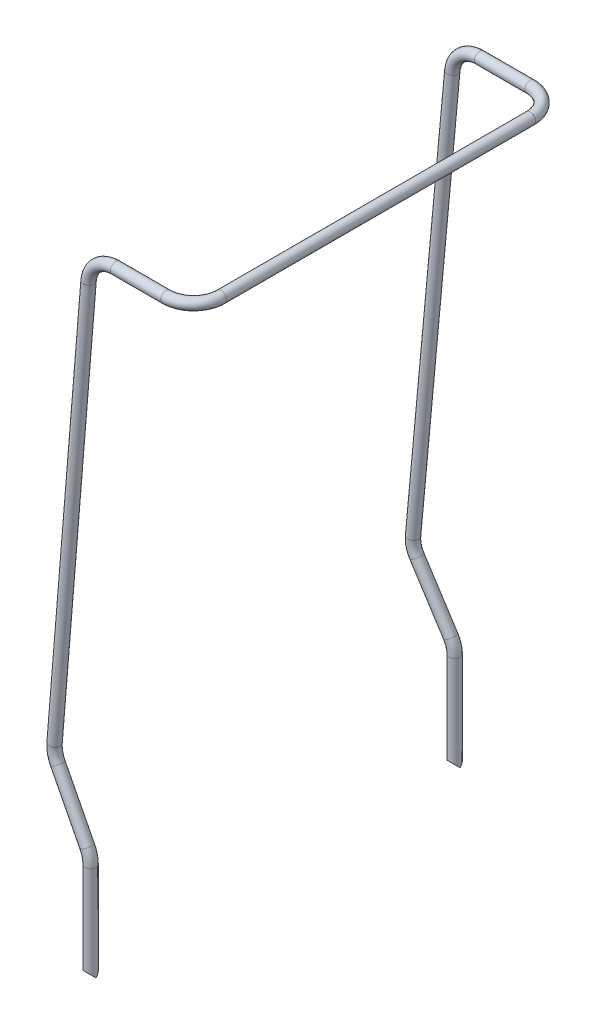
from build123d import *

# Parameters (mm, degrees)
SKETCH1_R                             = 7.9375
SKETCH1_R_2                           = 6.4375
PIPE_CONFIGURED_21_3_X_2_3_5_DEPTH    = 139.269057496
SKETCH1_ON_SEGMENT_2_R                = 7.9375
SKETCH1_ON_SEGMENT_2_R_2              = 6.4375
PIPE_CONFIGURED_21_3_X_2_3_5_2_ANGLE  = 30
SKETCH1_ON_SEGMENT_3_R                = 7.9375
SKETCH1_ON_SEGMENT_3_R_2              = 6.4375
PIPE_CONFIGURED_21_3_X_2_3_5_3_DEPTH  = 92.155116602
SKETCH1_ON_SEGMENT_4_R                = 7.9375
SKETCH1_ON_SEGMENT_4_R_2              = 6.4375
PIPE_CONFIGURED_21_3_X_2_3_5_4_ANGLE  = 35
SKETCH1_ON_SEGMENT_5_R                = 7.9375
SKETCH1_ON_SEGMENT_5_R_2              = 6.4375
PIPE_CONFIGURED_21_3_X_2_3_5_5_DEPTH  = 613.247713082
SKETCH1_ON_SEGMENT_6_R                = 7.9375
SKETCH1_ON_SEGMENT_6_R_2              = 6.4375
PIPE_CONFIGURED_21_3_X_2_3_5_6_ANGLE  = 85.012738731
SKETCH1_ON_SEGMENT_7_R                = 7.9375
SKETCH1_ON_SEGMENT_7_R_2              = 6.4375
PIPE_CONFIGURED_21_3_X_2_3_5_7_DEPTH  = 73.338571858
SKETCH1_ON_SEGMENT_8_R                = 7.9375
SKETCH1_ON_SEGMENT_8_R_2              = 6.4375
PIPE_CONFIGURED_21_3_X_2_3_5_8_ANGLE  = 90
SKETCH1_ON_SEGMENT_9_R                = 7.9375
SKETCH1_ON_SEGMENT_9_R_2              = 6.4375
PIPE_CONFIGURED_21_3_X_2_3_5_9_DEPTH  = 450
SKETCH1_ON_SEGMENT_10_R               = 7.9375
SKETCH1_ON_SEGMENT_10_R_2             = 6.4375
PIPE_CONFIGURED_21_3_X_2_3_5_10_ANGLE = 90
SKETCH1_ON_SEGMENT_11_R               = 7.9375
SKETCH1_ON_SEGMENT_11_R_2             = 6.4375
PIPE_CONFIGURED_21_3_X_2_3_5_11_DEPTH = 73.338571858
SKETCH1_ON_SEGMENT_12_R               = 7.9375
SKETCH1_ON_SEGMENT_12_R_2             = 6.4375
PIPE_CONFIGURED_21_3_X_2_3_5_12_ANGLE = 85.012738731
SKETCH1_ON_SEGMENT_13_R               = 7.9375
SKETCH1_ON_SEGMENT_13_R_2             = 6.4375
PIPE_CONFIGURED_21_3_X_2_3_5_13_DEPTH = 613.247713082
SKETCH1_ON_SEGMENT_14_R               = 7.9375
SKETCH1_ON_SEGMENT_14_R_2             = 6.4375
PIPE_CONFIGURED_21_3_X_2_3_5_14_ANGLE = 35
SKETCH1_ON_SEGMENT_15_R               = 7.9375
SKETCH1_ON_SEGMENT_15_R_2             = 6.4375
PIPE_CONFIGURED_21_3_X_2_3_5_15_DEPTH = 92.155116602
SKETCH1_ON_SEGMENT_16_R               = 7.9375
SKETCH1_ON_SEGMENT_16_R_2             = 6.4375
PIPE_CONFIGURED_21_3_X_2_3_5_16_ANGLE = 30
SKETCH1_ON_SEGMENT_17_R               = 7.9375
SKETCH1_ON_SEGMENT_17_R_2             = 6.4375
PIPE_CONFIGURED_21_3_X_2_3_5_17_DEPTH = 139.269057496
CORTE_EXTRUS_O3_DEPTH                 = 1435.431816843
CORTE_EXTRUS_O3_DEPTH_BACK            = 1435.431816843
ESBO_O12_R                            = 7.9375
ESBO_O14_R                            = 7.9375
CORTE_EXTRUS_O5_DEPTH                 = 30


with BuildPart() as part:
    # Sketch1 → Pipe - configured 21.3 X 2.3(5) (new body)
    with BuildSketch(Plane(origin=(910, 0, 265), x_dir=(1, 0, 0), z_dir=(0, 1, 0))):
        Circle(SKETCH1_R)
        Circle(SKETCH1_R_2, mode=Mode.SUBTRACT)
    extrude(amount=PIPE_CONFIGURED_21_3_X_2_3_5_DEPTH)


with BuildPart() as body_2:
    # Sketch1 on segment 2 (carried to the start of arc 2) → Pipe - configured 21.3 X 2.3_5 2 (revolve)
    with BuildSketch(Plane(origin=(910, 139.269057496, 265), x_dir=(1, 0, 0), z_dir=(0, 1, 0))):
        Circle(SKETCH1_ON_SEGMENT_2_R)
        Circle(SKETCH1_ON_SEGMENT_2_R_2, mode=Mode.SUBTRACT)
    revolve(axis=Axis((870.101652007, 139.269057496, 262.150118), (-0.07124705, 0, 0.9974587)), revolution_arc=PIPE_CONFIGURED_21_3_X_2_3_5_2_ANGLE)


with BuildPart() as body_3:
    # Sketch1 on segment 3 (carried to segment 3) → Pipe - configured 21.3 X 2.3_5 3 (new body)
    with BuildSketch(Plane(origin=(904.654634938, 159.269057496, 264.61818821), x_dir=(0.866705478, 0.49872935, -0.009521037), z_dir=(-0.49872935, 0.866025404, -0.035623525))):
        Circle(SKETCH1_ON_SEGMENT_3_R)
        Circle(SKETCH1_ON_SEGMENT_3_R_2, mode=Mode.SUBTRACT)
    extrude(amount=PIPE_CONFIGURED_21_3_X_2_3_5_3_DEPTH)


with BuildPart() as body_4:
    # Sketch1 on segment 4 (carried to the start of arc 4) → Pipe - configured 21.3 X 2.3_5 4 (revolve)
    with BuildSketch(Plane(origin=(858.694173544, 239.077729562, 261.33529811), x_dir=(0.866705478, 0.49872935, -0.009521037), z_dir=(-0.49872935, 0.866025404, -0.035623525))):
        Circle(SKETCH1_ON_SEGMENT_4_R)
        Circle(SKETCH1_ON_SEGMENT_4_R_2, mode=Mode.SUBTRACT)
    revolve(axis=Axis((893.247156475, 259.077729562, 263.80336832), (0.07124705, 0, -0.9974587)), revolution_arc=PIPE_CONFIGURED_21_3_X_2_3_5_4_ANGLE)


with BuildPart() as body_5:
    # Sketch1 on segment 5 (carried to segment 5) → Pipe - configured 21.3 X 2.3_5 5 (new body)
    with BuildSketch(Plane(origin=(853.500633741, 262.563959272, 260.964330982), x_dir=(0.996214014, -0.086934254, -0.000270428), z_dir=(0.086934254, 0.996194698, 0.00620959))):
        Circle(SKETCH1_ON_SEGMENT_5_R)
        Circle(SKETCH1_ON_SEGMENT_5_R_2, mode=Mode.SUBTRACT)
    extrude(amount=PIPE_CONFIGURED_21_3_X_2_3_5_5_DEPTH)


with BuildPart() as body_6:
    # Sketch1 on segment 6 (carried to the start of arc 6) → Pipe - configured 21.3 X 2.3_5 6 (revolve)
    with BuildSketch(Plane(origin=(906.8128661, 873.478079661, 264.772347579), x_dir=(0.996214014, -0.086934254, -0.000270428), z_dir=(0.086934254, 0.996194698, 0.00620959))):
        Circle(SKETCH1_ON_SEGMENT_6_R)
        Circle(SKETCH1_ON_SEGMENT_6_R_2, mode=Mode.SUBTRACT)
    revolve(axis=Axis((946.661428142, 870.00077706, 264.750672476), (0, 0.006233188, -0.999980573)), revolution_arc=PIPE_CONFIGURED_21_3_X_2_3_5_6_ANGLE)


with BuildPart() as body_7:
    # Sketch1 on segment 7 (carried to segment 7) → Pipe - configured 21.3 X 2.3_5 7 (new body)
    with BuildSketch(Plane(origin=(946.661428142, 910, 265), x_dir=(0, -1, 0), z_dir=(1, 0, 0))):
        Circle(SKETCH1_ON_SEGMENT_7_R)
        Circle(SKETCH1_ON_SEGMENT_7_R_2, mode=Mode.SUBTRACT)
    extrude(amount=PIPE_CONFIGURED_21_3_X_2_3_5_7_DEPTH)


with BuildPart() as body_8:
    # Sketch1 on segment 8 (carried to the start of arc 8) → Pipe - configured 21.3 X 2.3_5 8 (revolve)
    with BuildSketch(Plane(origin=(1020, 910, 265), x_dir=(0, -1, 0), z_dir=(1, 0, 0))):
        Circle(SKETCH1_ON_SEGMENT_8_R)
        Circle(SKETCH1_ON_SEGMENT_8_R_2, mode=Mode.SUBTRACT)
    revolve(axis=Axis((1020, 910, 225), (0, 1, 0)), revolution_arc=PIPE_CONFIGURED_21_3_X_2_3_5_8_ANGLE)


with BuildPart() as body_9:
    # Sketch1 on segment 9 (carried to segment 9) → Pipe - configured 21.3 X 2.3_5 9 (new body)
    with BuildSketch(Plane(origin=(1060, 910, 225), x_dir=(1, 0, 0), z_dir=(0, 0, -1))):
        Circle(SKETCH1_ON_SEGMENT_9_R)
        Circle(SKETCH1_ON_SEGMENT_9_R_2, mode=Mode.SUBTRACT)
    extrude(amount=PIPE_CONFIGURED_21_3_X_2_3_5_9_DEPTH)


with BuildPart() as body_10:
    # Sketch1 on segment 10 (carried to the start of arc 10) → Pipe - configured 21.3 X 2.3_5 10 (revolve)
    with BuildSketch(Plane(origin=(1060, 910, -225), x_dir=(1, 0, 0), z_dir=(0, 0, -1))):
        Circle(SKETCH1_ON_SEGMENT_10_R)
        Circle(SKETCH1_ON_SEGMENT_10_R_2, mode=Mode.SUBTRACT)
    revolve(axis=Axis((1020, 910, -225), (0, 1, 0)), revolution_arc=PIPE_CONFIGURED_21_3_X_2_3_5_10_ANGLE)


with BuildPart() as body_11:
    # Sketch1 on segment 11 (carried to segment 11) → Pipe - configured 21.3 X 2.3_5 11 (new body)
    with BuildSketch(Plane(origin=(1020, 910, -265), x_dir=(0, 1, 0), z_dir=(-1, 0, 0))):
        Circle(SKETCH1_ON_SEGMENT_11_R)
        Circle(SKETCH1_ON_SEGMENT_11_R_2, mode=Mode.SUBTRACT)
    extrude(amount=PIPE_CONFIGURED_21_3_X_2_3_5_11_DEPTH)


with BuildPart() as body_12:
    # Sketch1 on segment 12 (carried to the start of arc 12) → Pipe - configured 21.3 X 2.3_5 12 (revolve)
    with BuildSketch(Plane(origin=(946.661428142, 910, -265), x_dir=(0, 1, 0), z_dir=(-1, 0, 0))):
        Circle(SKETCH1_ON_SEGMENT_12_R)
        Circle(SKETCH1_ON_SEGMENT_12_R_2, mode=Mode.SUBTRACT)
    revolve(axis=Axis((946.661428142, 870.00077706, -264.750672476), (0, 0.006233188, 0.999980573)), revolution_arc=PIPE_CONFIGURED_21_3_X_2_3_5_12_ANGLE)


with BuildPart() as body_13:
    # Sketch1 on segment 13 (carried to segment 13) → Pipe - configured 21.3 X 2.3_5 13 (new body)
    with BuildSketch(Plane(origin=(853.500633741, 262.563959272, -260.964330982), x_dir=(0.996214014, -0.086934254, 0.000270428), z_dir=(0.086934254, 0.996194698, -0.00620959))):
        Circle(SKETCH1_ON_SEGMENT_13_R)
        Circle(SKETCH1_ON_SEGMENT_13_R_2, mode=Mode.SUBTRACT)
    extrude(amount=PIPE_CONFIGURED_21_3_X_2_3_5_13_DEPTH)


with BuildPart() as body_14:
    # Sketch1 on segment 14 (carried to the start of arc 14) → Pipe - configured 21.3 X 2.3_5 14 (revolve)
    with BuildSketch(Plane(origin=(858.694173544, 239.077729562, -261.33529811), x_dir=(0.866705478, 0.49872935, 0.009521037), z_dir=(-0.49872935, 0.866025404, 0.035623525))):
        Circle(SKETCH1_ON_SEGMENT_14_R)
        Circle(SKETCH1_ON_SEGMENT_14_R_2, mode=Mode.SUBTRACT)
    revolve(axis=Axis((893.247156475, 259.077729562, -263.80336832), (-0.07124705, 0, -0.9974587)), revolution_arc=PIPE_CONFIGURED_21_3_X_2_3_5_14_ANGLE)


with BuildPart() as body_15:
    # Sketch1 on segment 15 (carried to segment 15) → Pipe - configured 21.3 X 2.3_5 15 (new body)
    with BuildSketch(Plane(origin=(904.654634938, 159.269057496, -264.61818821), x_dir=(0.866705478, 0.49872935, 0.009521037), z_dir=(-0.49872935, 0.866025404, 0.035623525))):
        Circle(SKETCH1_ON_SEGMENT_15_R)
        Circle(SKETCH1_ON_SEGMENT_15_R_2, mode=Mode.SUBTRACT)
    extrude(amount=PIPE_CONFIGURED_21_3_X_2_3_5_15_DEPTH)


with BuildPart() as body_16:
    # Sketch1 on segment 16 (carried to the start of arc 16) → Pipe - configured 21.3 X 2.3_5 16 (revolve)
    with BuildSketch(Plane(origin=(910, 139.269057496, -265), x_dir=(1, 0, 0), z_dir=(0, 1, 0))):
        Circle(SKETCH1_ON_SEGMENT_16_R)
        Circle(SKETCH1_ON_SEGMENT_16_R_2, mode=Mode.SUBTRACT)
    revolve(axis=Axis((870.101652007, 139.269057496, -262.150118), (0.07124705, 0, 0.9974587)), revolution_arc=PIPE_CONFIGURED_21_3_X_2_3_5_16_ANGLE)


with BuildPart() as body_17:
    # Sketch1 on segment 17 (carried to segment 17) → Pipe - configured 21.3 X 2.3_5 17 (new body)
    with BuildSketch(Plane(origin=(910, 0, -265), x_dir=(1, 0, 0), z_dir=(0, 1, 0))):
        Circle(SKETCH1_ON_SEGMENT_17_R)
        Circle(SKETCH1_ON_SEGMENT_17_R_2, mode=Mode.SUBTRACT)
    extrude(amount=PIPE_CONFIGURED_21_3_X_2_3_5_17_DEPTH)


with BuildPart() as corte_extrus_o3_tool:
    # Esboço12 → Corte-extrusão3 (new, two sides: drawn at the far end of the back side and taken through both)
    with BuildSketch(Plane.XY.offset(-CORTE_EXTRUS_O3_DEPTH_BACK)):
        with Locations((910, 0)):
            Circle(ESBO_O12_R)
    extrude(amount=CORTE_EXTRUS_O3_DEPTH + CORTE_EXTRUS_O3_DEPTH_BACK)


with BuildPart() as part_1:
    add(part.part)

    # Corte-extrusão3: cut by corte_extrus_o3_tool
    add(corte_extrus_o3_tool.part, mode=Mode.SUBTRACT)


with BuildPart() as body_17_1:
    add(body_17.part)

    # Corte-extrusão3: cut by corte_extrus_o3_tool
    add(corte_extrus_o3_tool.part, mode=Mode.SUBTRACT)


with BuildPart() as corte_extrus_o5_tool:
    # Esboço14 → Corte-extrusão5 (new body)
    with BuildSketch(Plane(origin=(910, 0, 0), x_dir=(0, 0, -1), z_dir=(1, 0, 0))):
        with Locations((-265, 0)):
            Circle(ESBO_O14_R)
        with Locations((265, 0)):
            Circle(ESBO_O14_R)
    extrude(amount=-CORTE_EXTRUS_O5_DEPTH)


with BuildPart() as part_2:
    add(part_1.part)

    # Corte-extrusão5: cut by corte_extrus_o5_tool
    add(corte_extrus_o5_tool.part, mode=Mode.SUBTRACT)


with BuildPart() as body_17_2:
    add(body_17_1.part)

    # Corte-extrusão5: cut by corte_extrus_o5_tool
    add(corte_extrus_o5_tool.part, mode=Mode.SUBTRACT)


solid = Compound([body_2.part, body_3.part, body_4.part, body_5.part, body_6.part, body_7.part, body_8.part, body_9.part, body_10.part, body_11.part, body_12.part, body_13.part, body_14.part, body_15.part, body_16.part, part_2.part, body_17_2.part])
